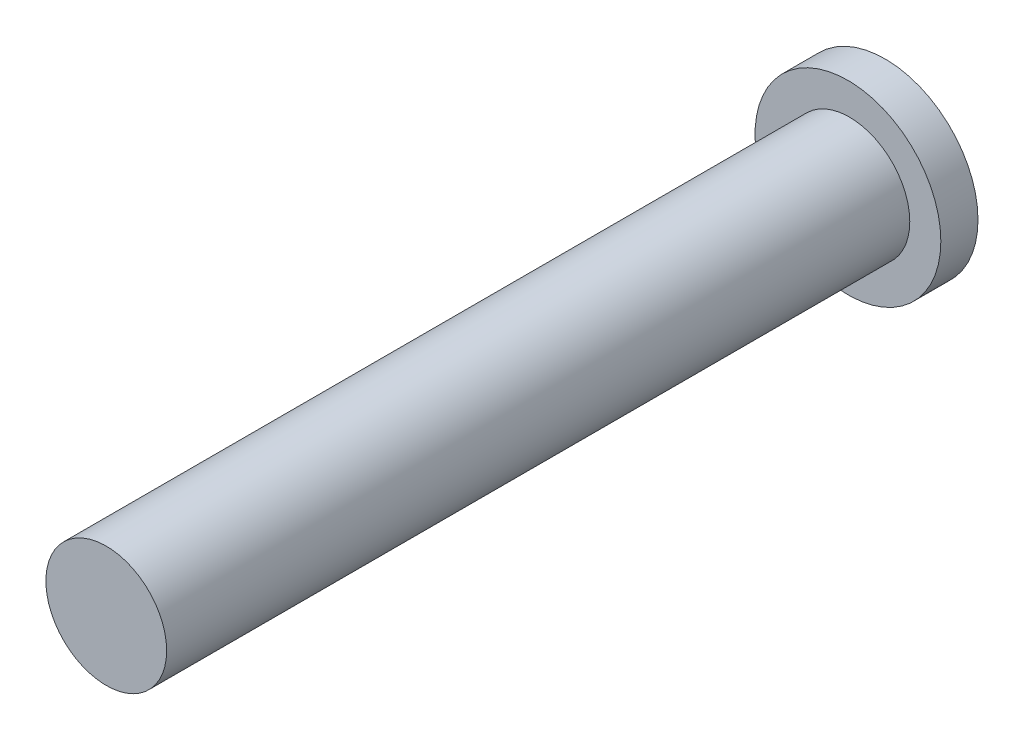
from build123d import *

# Parameters (mm, degrees)
SKETCH2_R           = 5
BOSS_EXTRUDE1_DEPTH = 2
SKETCH3_R           = 3.25
BOSS_EXTRUDE2_DEPTH = 40


with BuildPart() as part:
    # Sketch2 → Boss-Extrude1 (new body)
    with BuildSketch(Plane.XY):
        with Locations((-2.465687425, 0.403476124)):
            Circle(SKETCH2_R)
    extrude(amount=BOSS_EXTRUDE1_DEPTH)

    # Sketch3 → Boss-Extrude2 (add)
    with BuildSketch(Plane.XY.offset(2)):
        with Locations((-2.387555185, 0.481608364)):
            Circle(SKETCH3_R)
    extrude(amount=BOSS_EXTRUDE2_DEPTH)


solid = part.part
